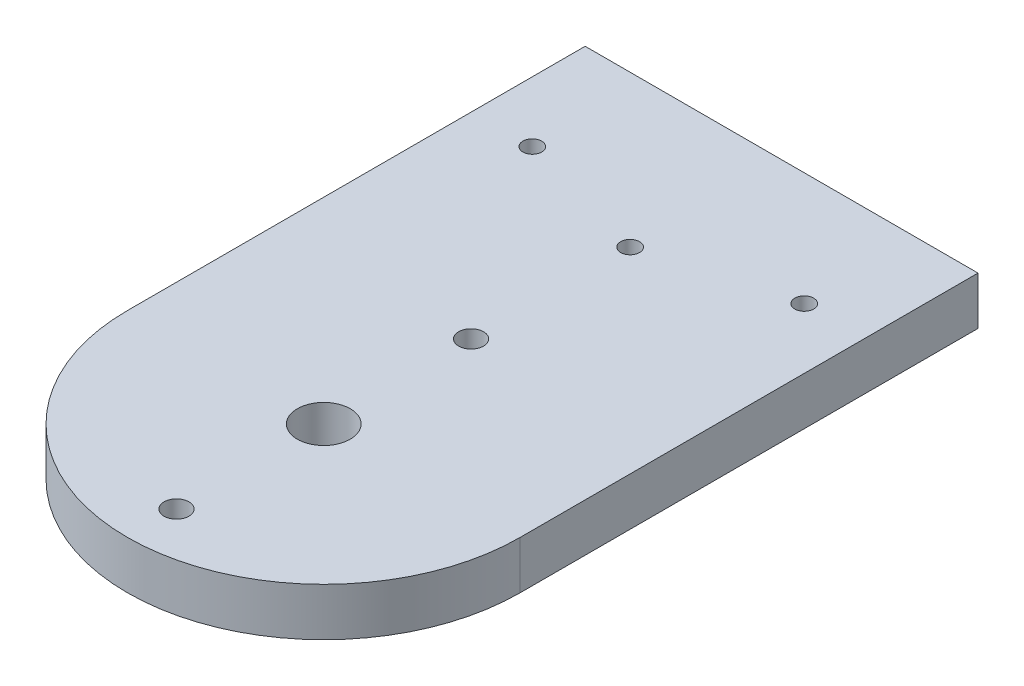
from build123d import *

# Parameters (mm, degrees)
PARED_B_CHUMACERA_J5_START          = -10.525
CROQUIS1_W                          = 52
CROQUIS1_H                          = 60.6
PARED_B_CHUMACERA_J5_DEPTH          = 6.35
PARED_B_CHUMACERA_J5_REDONDEO_START = -10.525
CROQUIS2_R                          = 26
PARED_B_CHUMACERA_J5_REDONDEO_DEPTH = 6.35
PASO_PERNO_Y_ROSCA_M4_KFL08_START   = -10.525
CROQUIS3_R                          = 3.5
CROQUIS3_R_2                        = 1.65
PASO_PERNO_Y_ROSCA_M4_KFL08_DEPTH   = 6.35
ROSCA_M3_ESCUADRAS_START            = -10.525
CROQUIS4_R                          = 1.25
ROSCA_M3_ESCUADRAS_DEPTH            = 6.35
PASADORES_D4_START                  = 275.95
CROQUIS5_R                          = 2
PASADORES_D4_DEPTH                  = 8
ROSCA_M3_BASES_CINCHO_START         = -10.525
CROQUIS6_R                          = 1.25
ROSCA_M3_BASES_CINCHO_DEPTH         = 6.35


with BuildPart() as part:
    # Croquis1 → Pared_B_chumacera_J5 (new body)
    with BuildSketch(Plane(origin=(0, 0, 0), x_dir=(1, 0, 0), z_dir=(0, 1, 0)).offset(PARED_B_CHUMACERA_J5_START)):
        with Locations((152.4, -306.25)):
            Rectangle(CROQUIS1_W, CROQUIS1_H)
    extrude(amount=PARED_B_CHUMACERA_J5_DEPTH)

    # Croquis2 → Pared_B_chumacera_J5_redondeo (add)
    with BuildSketch(Plane(origin=(0, 0, 0), x_dir=(1, 0, 0), z_dir=(0, 1, 0)).offset(PARED_B_CHUMACERA_J5_REDONDEO_START)):
        with Locations((152.4, -336.55)):
            Circle(CROQUIS2_R)
    extrude(amount=PARED_B_CHUMACERA_J5_REDONDEO_DEPTH)

    # Croquis3 → Paso_perno_y_rosca_M4_KFL08 (cut)
    with BuildSketch(Plane(origin=(0, 0, 0), x_dir=(1, 0, 0), z_dir=(0, 1, 0)).offset(PASO_PERNO_Y_ROSCA_M4_KFL08_START)):
        with Locations(Location((152.4, -336.55, 0), (0, 0, 90))):
            Circle(CROQUIS3_R)
        with Locations(Location((152.4, -356.05, 0), (0, 0, 90))):
            Circle(CROQUIS3_R_2)
        with Locations(Location((152.4, -317.05, 0), (0, 0, 90))):
            Circle(CROQUIS3_R_2)
    extrude(amount=PASO_PERNO_Y_ROSCA_M4_KFL08_DEPTH, mode=Mode.SUBTRACT)

    # Croquis4 → Rosca_M3_escuadras (cut)
    with BuildSketch(Plane(origin=(0, 0, 0), x_dir=(1, 0, 0), z_dir=(0, 1, 0)).offset(ROSCA_M3_ESCUADRAS_START)):
        with Locations(Location((134.4, -290.95, 0), (0, 0, 90))):
            Circle(CROQUIS4_R)
        with Locations(Location((170.4, -290.95, 0), (0, 0, 90))):
            Circle(CROQUIS4_R)
    extrude(amount=ROSCA_M3_ESCUADRAS_DEPTH, mode=Mode.SUBTRACT)

    # Croquis5 → Pasadores_D4 (cut)
    with BuildSketch(Plane.XY.offset(PASADORES_D4_START)):
        with Locations((130.4, -7.35)):
            Circle(CROQUIS5_R)
        with Locations((174.4, -7.35)):
            Circle(CROQUIS5_R)
    extrude(amount=PASADORES_D4_DEPTH, mode=Mode.SUBTRACT)

    # Croquis6 → Rosca_M3_bases_cincho (cut)
    with BuildSketch(Plane(origin=(0, 0, 0), x_dir=(1, 0, 0), z_dir=(0, 1, 0)).offset(ROSCA_M3_BASES_CINCHO_START)):
        with Locations(Location((152.4, -296, 0), (0, 0, 90))):
            Circle(CROQUIS6_R)
    extrude(amount=ROSCA_M3_BASES_CINCHO_DEPTH, mode=Mode.SUBTRACT)


solid = part.part
